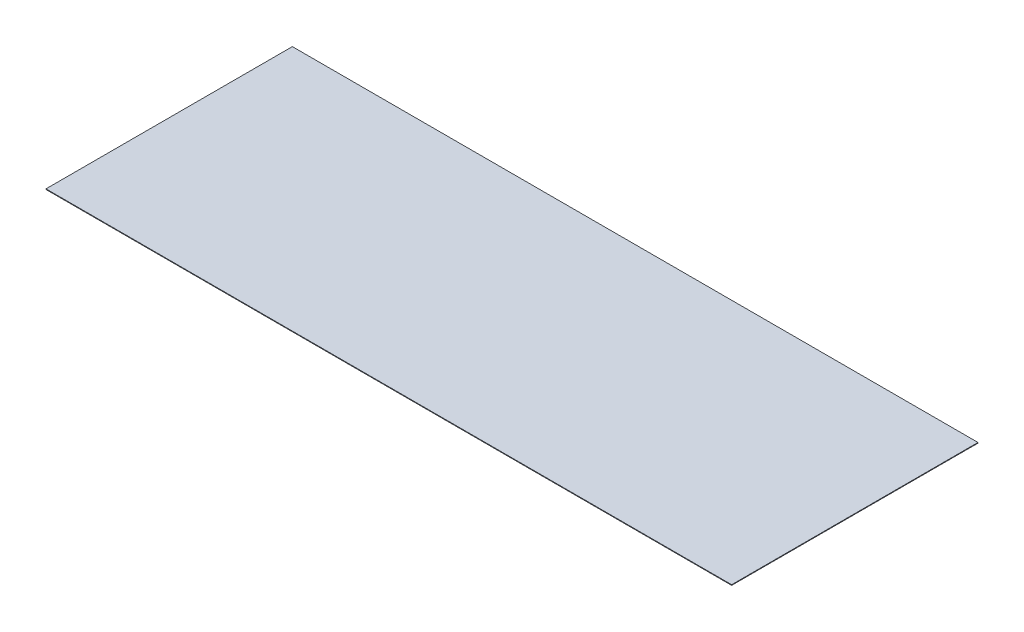
from build123d import *

# Parameters (mm, degrees)
SKETCH1_W           = 113
SKETCH1_H           = 40.6
BOSS_EXTRUDE1_DEPTH = 0.1


with BuildPart() as part:
    # Sketch1 → Boss-Extrude1 (new body)
    with BuildSketch(Plane(origin=(0, 0, 0), x_dir=(1, 0, 0), z_dir=(0, 1, 0))):
        Rectangle(SKETCH1_W, SKETCH1_H)
    extrude(amount=BOSS_EXTRUDE1_DEPTH)


solid = part.part
